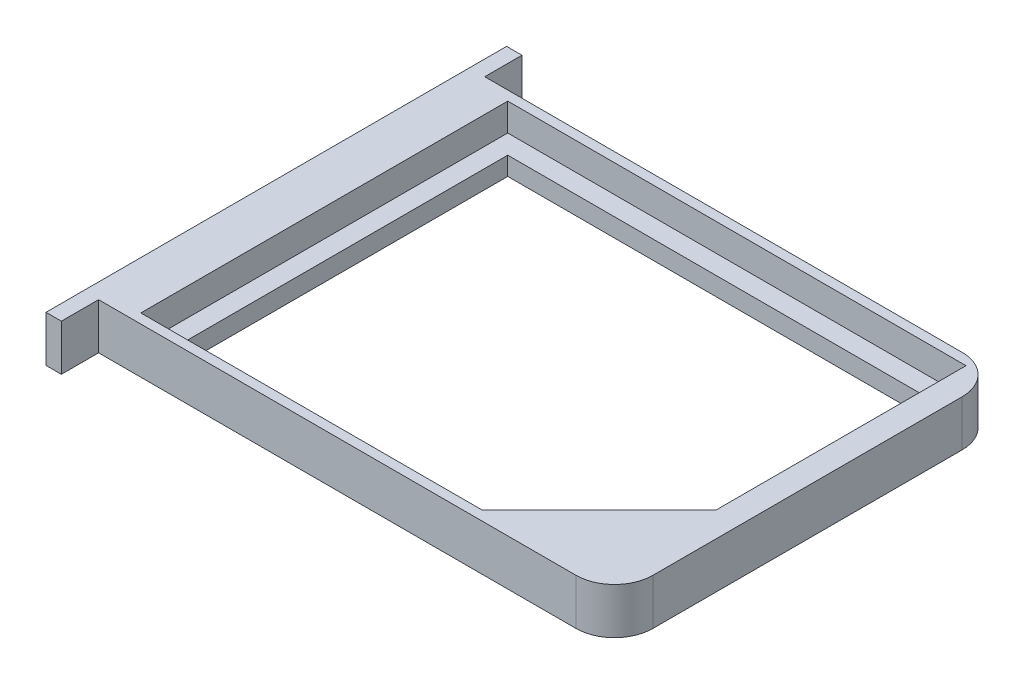
from build123d import *

# Parameters (mm, degrees)
BOSS_EXTRUDE1_DEPTH = 1.524
SKETCH2_W           = 15.1638
SKETCH2_H           = 12.1412
CUT_EXTRUDE1_DEPTH  = 22.375167739
BOSS_EXTRUDE2_DEPTH = 1.524
BOSS_EXTRUDE3_DEPTH = 0.6096
SKETCH7_W           = 15.24
SKETCH7_H           = 1.524
BOSS_EXTRUDE4_DEPTH = 0.508


with BuildPart() as part:
    # Sketch1 → Boss-Extrude1 (new body)
    with BuildSketch(Plane(origin=(0, 0, 0), x_dir=(1, 0, 0), z_dir=(0, 1, 0))):
        with BuildLine():
            Line((0, 0), (15.7988, 0))
            ThreePointArc((15.7988, 0), (16.696825612, 0.371974388), (17.0688, 1.27))
            Line((17.0688, 1.27), (17.0688, 11.5062))
            ThreePointArc((17.0688, 11.5062), (16.696825612, 12.404225612), (15.7988, 12.7762))
            Line((15.7988, 12.7762), (0, 12.7762))
            Line((0, 12.7762), (0, 0))
        make_face()
    extrude(amount=BOSS_EXTRUDE1_DEPTH)

    # Sketch2 → Cut-Extrude1 (cut, through all)
    with BuildSketch(Plane(origin=(0, 1.524, 0), x_dir=(1, 0, 0), z_dir=(0, 1, 0))):
        with Locations((8.6614, 6.3881)):
            Rectangle(SKETCH2_W, SKETCH2_H)
    extrude(amount=-CUT_EXTRUDE1_DEPTH, mode=Mode.SUBTRACT)

    # Sketch3 → Boss-Extrude2 (add)
    with BuildSketch(Plane(origin=(0, 0, 0), x_dir=(1, 0, 0), z_dir=(0, 1, 0))):
        Polygon((12.369415055, 0.3175), (16.2433, 4.191384945), (16.2433, 0.3175), align=None)
    extrude(amount=BOSS_EXTRUDE2_DEPTH)

    # Sketch5 → Boss-Extrude3 (add)
    with BuildSketch(Plane(origin=(0, 0, 0), x_dir=(1, 0, 0), z_dir=(0, 1, 0))):
        Polygon((1.0795, 0.3175), (12.369415055, 0.3175), (16.2433, 4.191384945), (16.2433, 12.4587), (1.0795, 12.4587), align=None)
        Polygon((1.7145, 11.8237), (1.7145, 0.9525), (12.106389443, 0.9525), (15.6083, 4.454410557), (15.6083, 11.8237), align=None, mode=Mode.SUBTRACT)
    extrude(amount=BOSS_EXTRUDE3_DEPTH)

    # Sketch7 → Boss-Extrude4 (add)
    with BuildSketch(Plane.ZY):
        with Locations((-6.3881, 0.762)):
            Rectangle(SKETCH7_W, SKETCH7_H)
    extrude(amount=BOSS_EXTRUDE4_DEPTH)


solid = part.part
